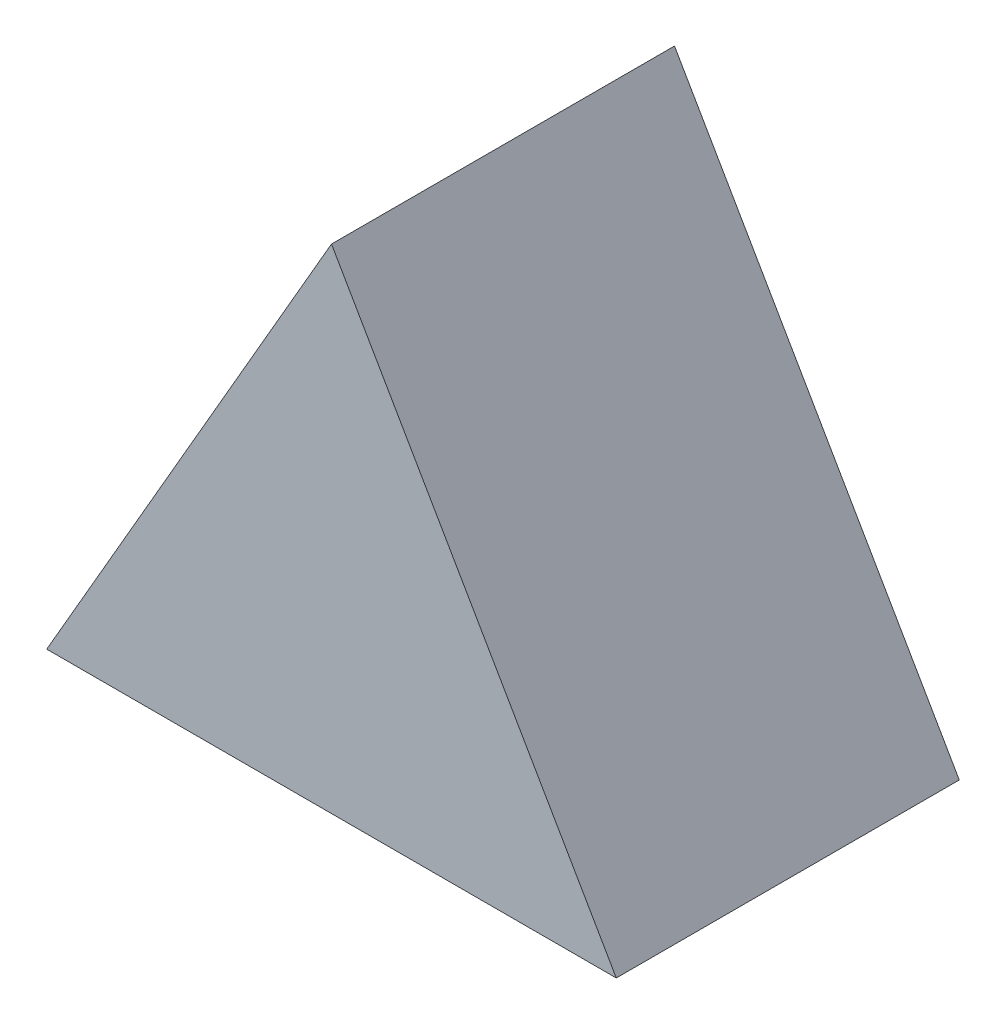
from build123d import *

# Parameters (mm, degrees)
EXTRUDE_1_DEPTH = 3.8


with BuildPart() as part:
    # Эскиз1 → Бобышка-Вытянуть1 (new body)
    with BuildSketch(Plane.XY):
        Polygon((-0.309101615, 3.464620298), (-3.464101615, -2), (2.845898385, -2), align=None)
    extrude(amount=EXTRUDE_1_DEPTH)


solid = part.part
